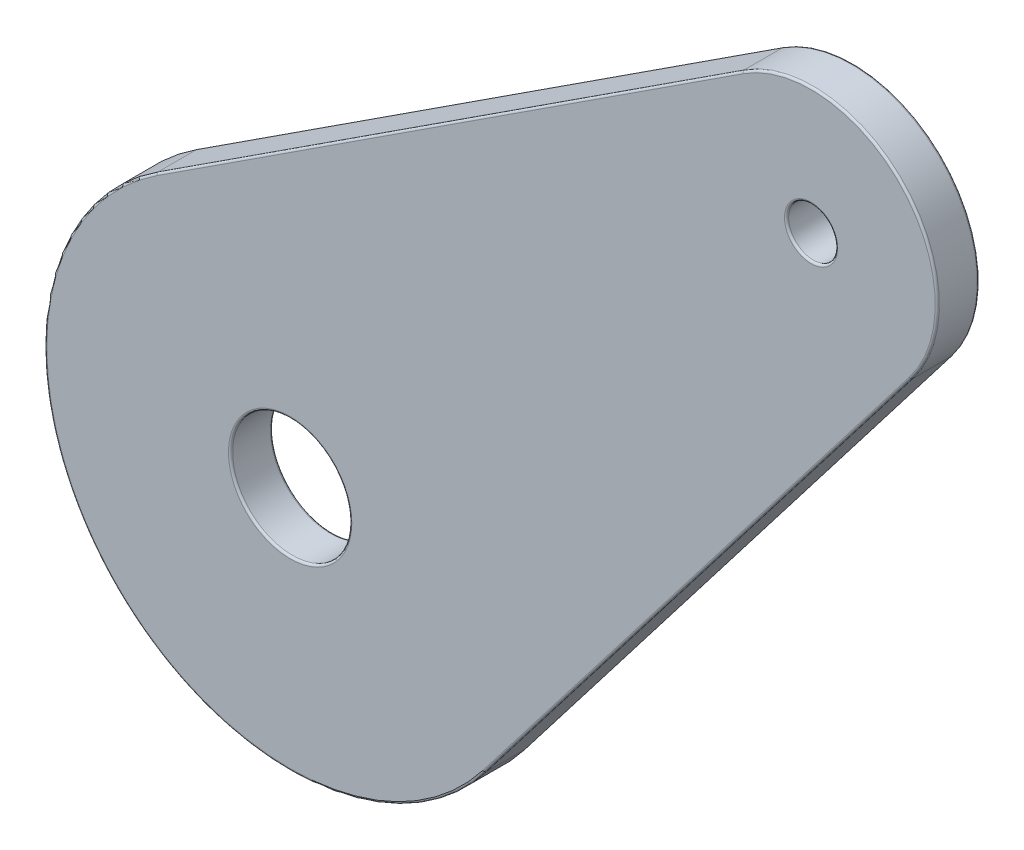
from build123d import *

# Parameters (mm, degrees)
SKETCH1_R           = 4.25
SKETCH1_R_2         = 1.75
BOSS_EXTRUDE1_DEPTH = 3
FILLET2_R           = 0.15


with BuildPart() as part:
    # Sketch1 → Boss-Extrude1 (new body)
    with BuildSketch(Plane.XY):
        with BuildLine():
            Line((-6.355257907, 46.902035461), (24.061140419, 86.396034215))
            ThreePointArc((24.061140419, 86.396034215), (23.542637098, 97.993482955), (12.023043472, 99.431754711))
            Line((12.023043472, 99.431754711), (-29.762668638, 72.249269759))
            ThreePointArc((-29.762668638, 72.249269759), (-33.07654119, 45.707369768), (-6.355257907, 46.902035461))
        make_face()
        with Locations((-20.22, 57.58)):
            Circle(SKETCH1_R, mode=Mode.SUBTRACT)
        with Locations((16.930701629, 91.887558835)):
            Circle(SKETCH1_R_2, mode=Mode.SUBTRACT)
    extrude(amount=BOSS_EXTRUDE1_DEPTH)

    # Fillet2
    fillet2_edges = [part.edges().sort_by_distance(p)[0] for p in [
        (15.180701629, 91.887558835, 0),
        (-24.47, 57.58, 3),
        (23.542637098, 97.993482955, 3),
        (-8.869812583, 85.840512235, 3),
        (-33.07654119, 45.707369768, 3),
        (8.852941256, 66.649034838, 3),
        (15.180701629, 91.887558835, 3),
        (8.852941256, 66.649034838, 0),
        (-33.07654119, 45.707369768, 0),
        (-8.869812583, 85.840512235, 0),
        (23.542637098, 97.993482955, 0),
        (-24.47, 57.58, 0),
    ]]
    fillet(fillet2_edges, radius=FILLET2_R)


solid = part.part
